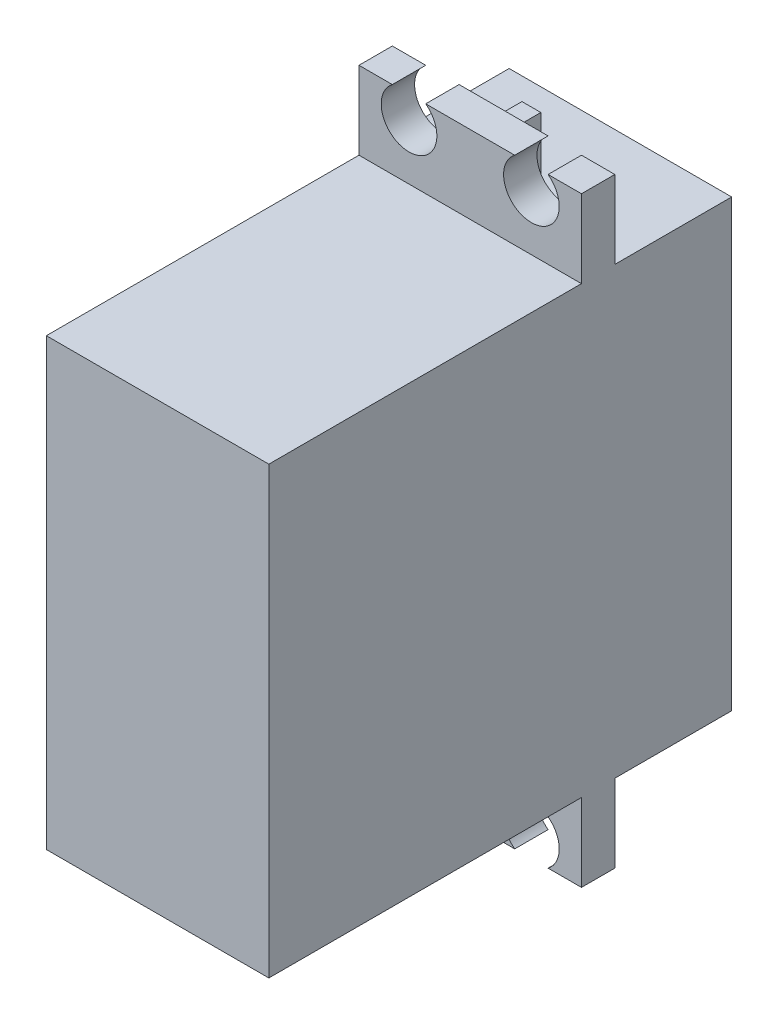
from build123d import *

# Parameters (mm, degrees)
SKETCH1_W           = 20
SKETCH1_H           = 40
BOSS_EXTRUDE1_DEPTH = 41.6
SKETCH2_R           = 3
SKETCH2_R_2         = 1.5
BOSS_EXTRUDE2_DEPTH = 4
BOSS_EXTRUDE3_START = -13.5
BOSS_EXTRUDE3_DEPTH = 3
SKETCH5_W           = 1.7
SKETCH5_H           = 6
BOSS_EXTRUDE4_DEPTH = 2.5


with BuildPart() as part:
    # Sketch1 → Boss-Extrude1 (new body)
    with BuildSketch(Plane.XY):
        Rectangle(SKETCH1_W, SKETCH1_H)
    extrude(amount=BOSS_EXTRUDE1_DEPTH)

    # Sketch2 → Boss-Extrude2 (add)
    with BuildSketch(Plane(origin=(0, 0, 0), x_dir=(-1, 0, 0), z_dir=(0, 0, -1))):
        with Locations((0, 10)):
            Circle(SKETCH2_R)
        with Locations((0, 10)):
            Circle(SKETCH2_R_2, mode=Mode.SUBTRACT)
    extrude(amount=BOSS_EXTRUDE2_DEPTH)

    # Sketch3 → Boss-Extrude3 (add)
    with BuildSketch(Plane(origin=(0, 0, 0), x_dir=(-1, 0, 0), z_dir=(0, 0, -1)).offset(BOSS_EXTRUDE3_START)):
        with BuildLine():
            Line((-10, 27), (-10, 20))
            Line((-10, 20), (10, 20))
            Line((10, 20), (10, 27))
            Line((10, 27), (7, 27))
            ThreePointArc((7, 27), (7.736067977, 26.118033989), (8, 25))
            ThreePointArc((8, 25), (4.381966011, 22.763932023), (4, 27))
            Line((4, 27), (-4, 27))
            ThreePointArc((-4, 27), (-3.263932023, 26.118033989), (-3, 25))
            ThreePointArc((-3, 25), (-6.618033989, 22.763932023), (-7, 27))
            Line((-7, 27), (-10, 27))
        make_face()
        with BuildLine():
            Line((10, -20), (-10, -20))
            Line((-10, -20), (-10, -27))
            Line((-10, -27), (-7, -27))
            ThreePointArc((-7, -27), (-6.618033989, -22.763932023), (-3, -25))
            ThreePointArc((-3, -25), (-3.263932023, -26.118033989), (-4, -27))
            Line((-4, -27), (4, -27))
            ThreePointArc((4, -27), (4.381966011, -22.763932023), (8, -25))
            ThreePointArc((8, -25), (7.736067977, -26.118033989), (7, -27))
            Line((7, -27), (10, -27))
            Line((10, -27), (10, -20))
        make_face()
    extrude(amount=BOSS_EXTRUDE3_DEPTH)

    # Sketch5 → Boss-Extrude4 (add)
    with BuildSketch(Plane(origin=(0, 0, 10.5), x_dir=(-1, 0, 0), z_dir=(0, 0, -1))):
        with Locations((0, 23)):
            Rectangle(SKETCH5_W, SKETCH5_H)
        with Locations((0, -23)):
            Rectangle(SKETCH5_W, SKETCH5_H)
    extrude(amount=BOSS_EXTRUDE4_DEPTH)


solid = part.part
